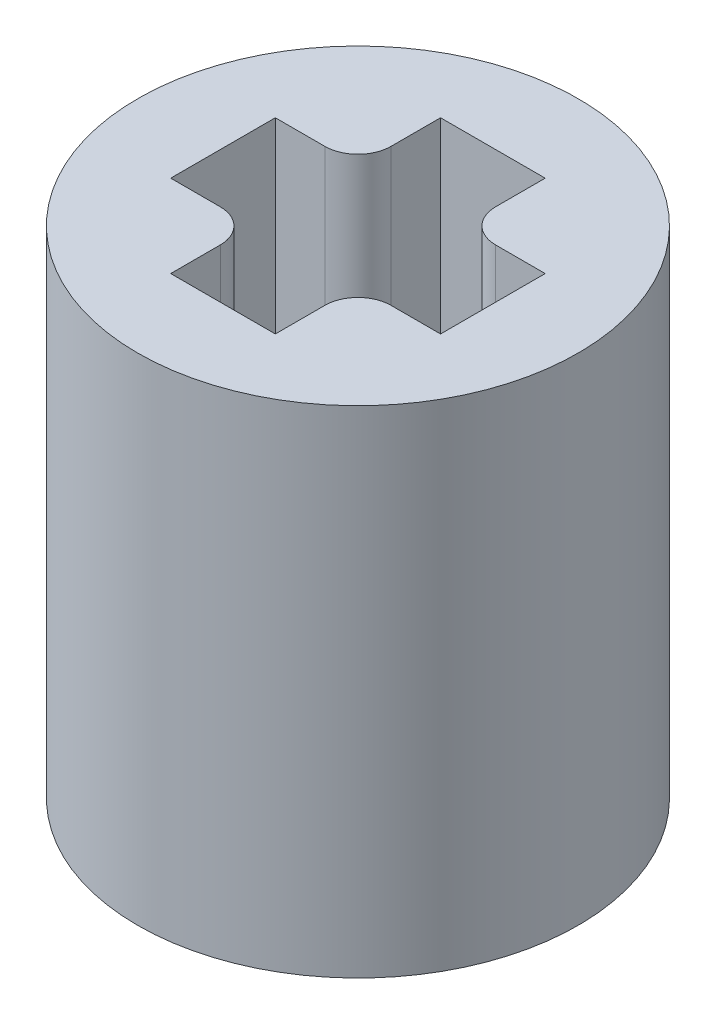
from build123d import *

# Parameters (mm, degrees)
SKETCH1_R           = 4
SKETCH1_R_2         = 2.5
BOSS_EXTRUDE1_DEPTH = 4
SKETCH3_R           = 4
BOSS_EXTRUDE2_DEPTH = 5
SKETCH4_W           = 1.5
SKETCH4_H           = 1.9
SKETCH4_W_2         = 1.9
SKETCH4_H_2         = 1.5
CUT_EXTRUDE1_DEPTH  = 4
FILLET1_R           = 0.6


with BuildPart() as part:
    # Sketch1 → Boss-Extrude1 (new body)
    with BuildSketch(Plane(origin=(0, 0, 0), x_dir=(1, 0, 0), z_dir=(0, 1, 0))):
        with Locations(Location((0, 0, 0), (0, 0, 270))):
            Circle(SKETCH1_R)
        with Locations(Location((0, 0, 0), (0, 0, 270))):
            Circle(SKETCH1_R_2, mode=Mode.SUBTRACT)
    extrude(amount=BOSS_EXTRUDE1_DEPTH)

    # Sketch3 → Boss-Extrude2 (add)
    with BuildSketch(Plane(origin=(0, 4, 0), x_dir=(1, 0, 0), z_dir=(0, 1, 0))):
        with Locations(Location((0, 0, 0), (0, 0, 270))):
            Circle(SKETCH3_R)
    extrude(amount=BOSS_EXTRUDE2_DEPTH)

    # Sketch4 → Cut-Extrude1 (cut)
    with BuildSketch(Plane(origin=(0, 9, 0), x_dir=(1, 0, 0), z_dir=(0, 1, 0))):
        with Locations((-1.7, 0)):
            Rectangle(SKETCH4_W, SKETCH4_H)
        with Locations((0, 1.7)):
            Rectangle(SKETCH4_W_2, SKETCH4_H_2)
        with Locations((1.7, 0)):
            Rectangle(SKETCH4_W, SKETCH4_H)
        Rectangle(SKETCH4_W_2, SKETCH4_H)
        with Locations((0, -1.7)):
            Rectangle(SKETCH4_W_2, SKETCH4_H_2)
    extrude(amount=-CUT_EXTRUDE1_DEPTH, mode=Mode.SUBTRACT)

    # Fillet1
    fillet1_edges = [part.edges().sort_by_distance(p)[0] for p in [
        (-0.95, 7, -0.95),
        (0.95, 7, -0.95),
        (0.95, 7, 0.95),
        (-0.95, 7, 0.95),
    ]]
    fillet(fillet1_edges, radius=FILLET1_R)


solid = part.part
